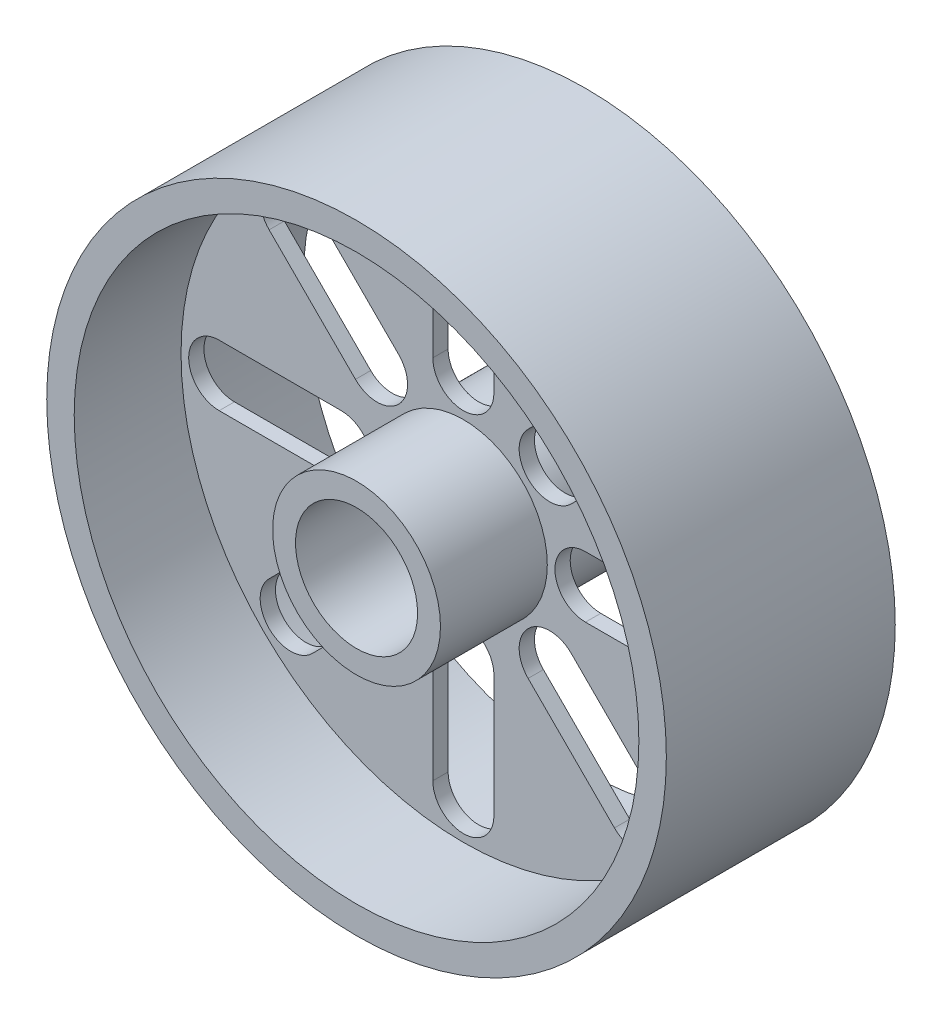
from build123d import *

# Parameters (mm, degrees)
SKETCH1_R           = 101.5
SKETCH1_R_2         = 20
BOSS_EXTRUDE1_DEPTH = 75
SKETCH2_R           = 92.5
SKETCH2_R_2         = 27.5
CUT_EXTRUDE1_DEPTH  = 35
CUT_EXTRUDE2_START  = -35
SKETCH3_R           = 92.5
SKETCH3_R_2         = 27.5
CUT_EXTRUDE2_DEPTH  = 35


with BuildPart() as part:
    # Sketch1 → Boss-Extrude1 (new body)
    with BuildSketch(Plane.XY):
        Circle(SKETCH1_R)
        Circle(SKETCH1_R_2, mode=Mode.SUBTRACT)
        with BuildLine():
            Line((10, 80), (10, 40))
            ThreePointArc((10, 40), (0, 30), (-10, 40))
            Line((-10, 40), (-10, 80))
            ThreePointArc((-10, 80), (0, 90), (10, 80))
        make_face(mode=Mode.SUBTRACT)
        with BuildLine():
            Line((63.639610307, 49.497474683), (35.355339059, 21.213203436))
            ThreePointArc((35.355339059, 21.213203436), (21.213203436, 21.213203436), (21.213203436, 35.355339059))
            Line((21.213203436, 35.355339059), (49.497474683, 63.639610307))
            ThreePointArc((49.497474683, 63.639610307), (63.639610307, 63.639610307), (63.639610307, 49.497474683))
        make_face(mode=Mode.SUBTRACT)
        with BuildLine():
            Line((80, -10), (40, -10))
            ThreePointArc((40, -10), (30, 0), (40, 10))
            Line((40, 10), (80, 10))
            ThreePointArc((80, 10), (90, 0), (80, -10))
        make_face(mode=Mode.SUBTRACT)
        with BuildLine():
            Line((49.497474683, -63.639610307), (21.213203436, -35.355339059))
            ThreePointArc((21.213203436, -35.355339059), (21.213203436, -21.213203436), (35.355339059, -21.213203436))
            Line((35.355339059, -21.213203436), (63.639610307, -49.497474683))
            ThreePointArc((63.639610307, -49.497474683), (63.639610307, -63.639610307), (49.497474683, -63.639610307))
        make_face(mode=Mode.SUBTRACT)
        with BuildLine():
            Line((-10, -80), (-10, -40))
            ThreePointArc((-10, -40), (0, -30), (10, -40))
            Line((10, -40), (10, -80))
            ThreePointArc((10, -80), (0, -90), (-10, -80))
        make_face(mode=Mode.SUBTRACT)
        with BuildLine():
            Line((-63.639610307, -49.497474683), (-35.355339059, -21.213203436))
            ThreePointArc((-35.355339059, -21.213203436), (-21.213203436, -21.213203436), (-21.213203436, -35.355339059))
            Line((-21.213203436, -35.355339059), (-49.497474683, -63.639610307))
            ThreePointArc((-49.497474683, -63.639610307), (-63.639610307, -63.639610307), (-63.639610307, -49.497474683))
        make_face(mode=Mode.SUBTRACT)
        with BuildLine():
            Line((-80, 10), (-40, 10))
            ThreePointArc((-40, 10), (-30, 0), (-40, -10))
            Line((-40, -10), (-80, -10))
            ThreePointArc((-80, -10), (-90, 0), (-80, 10))
        make_face(mode=Mode.SUBTRACT)
        with BuildLine():
            Line((-49.497474683, 63.639610307), (-21.213203436, 35.355339059))
            ThreePointArc((-21.213203436, 35.355339059), (-21.213203436, 21.213203436), (-35.355339059, 21.213203436))
            Line((-35.355339059, 21.213203436), (-63.639610307, 49.497474683))
            ThreePointArc((-63.639610307, 49.497474683), (-63.639610307, 63.639610307), (-49.497474683, 63.639610307))
        make_face(mode=Mode.SUBTRACT)
    extrude(amount=BOSS_EXTRUDE1_DEPTH)

    # Sketch2 → Cut-Extrude1 (cut)
    with BuildSketch(Plane.XY.offset(75)):
        Circle(SKETCH2_R)
        Circle(SKETCH2_R_2, mode=Mode.SUBTRACT)
    extrude(amount=-CUT_EXTRUDE1_DEPTH, mode=Mode.SUBTRACT)

    # Sketch3 → Cut-Extrude2 (cut)
    with BuildSketch(Plane(origin=(0, 0, 0), x_dir=(-1, 0, 0), z_dir=(0, 0, -1)).offset(CUT_EXTRUDE2_START)):
        with Locations(Location((0, 0, 0), (0, 0, 180))):
            Circle(SKETCH3_R)
        with Locations(Location((0, 0, 0), (0, 0, 180))):
            Circle(SKETCH3_R_2, mode=Mode.SUBTRACT)
    extrude(amount=CUT_EXTRUDE2_DEPTH, mode=Mode.SUBTRACT)


solid = part.part
